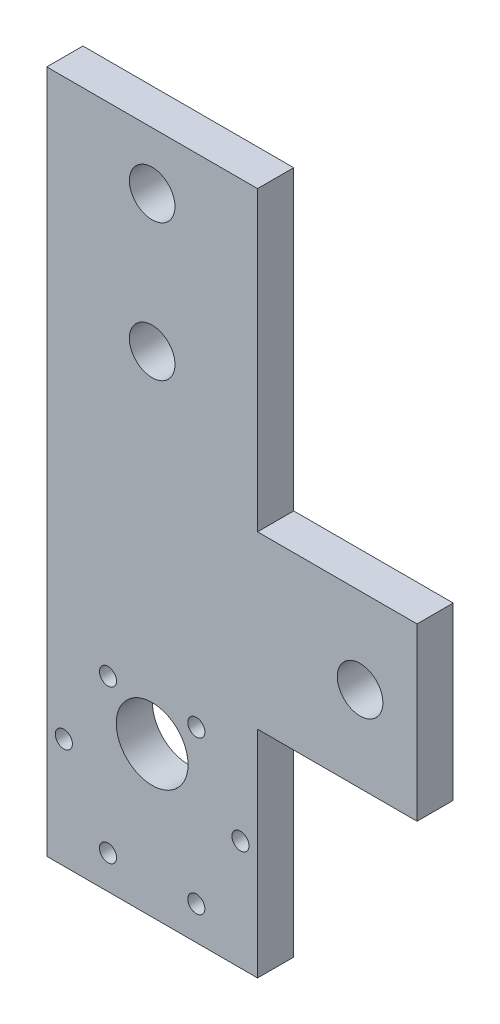
from build123d import *

# Parameters (mm, degrees)
SKETCH1_R           = 1.5
SKETCH1_R_2         = 6.3
SKETCH1_R_3         = 4
BOSS_EXTRUDE2_DEPTH = 6.35


with BuildPart() as part:
    # Sketch1 → Boss-Extrude2 (new body)
    with BuildSketch(Plane.XY):
        Polygon((-18.5, 100.675), (18.5, 100.675), (18.5, 48.5), (46.5, 48.5), (46.5, 18.5), (18.5, 18.5), (18.5, -19.325), (-18.5, -19.325), align=None)
        with Locations((-7.75, 13.423393759)):
            Circle(SKETCH1_R, mode=Mode.SUBTRACT)
        with Locations((7.75, 13.423393759)):
            Circle(SKETCH1_R, mode=Mode.SUBTRACT)
        with Locations((15.5, 0)):
            Circle(SKETCH1_R, mode=Mode.SUBTRACT)
        with Locations((7.75, -13.423393759)):
            Circle(SKETCH1_R, mode=Mode.SUBTRACT)
        with Locations((-7.75, -13.423393759)):
            Circle(SKETCH1_R, mode=Mode.SUBTRACT)
        with Locations((-15.5, 0)):
            Circle(SKETCH1_R, mode=Mode.SUBTRACT)
        with Locations((0, 7)):
            Circle(SKETCH1_R_2, mode=Mode.SUBTRACT)
        with Locations((0, 90.675)):
            Circle(SKETCH1_R_3, mode=Mode.SUBTRACT)
        with Locations((0, 66.675)):
            Circle(SKETCH1_R_3, mode=Mode.SUBTRACT)
        with Locations((36.5, 33.5)):
            Circle(SKETCH1_R_3, mode=Mode.SUBTRACT)
    extrude(amount=BOSS_EXTRUDE2_DEPTH)


solid = part.part
